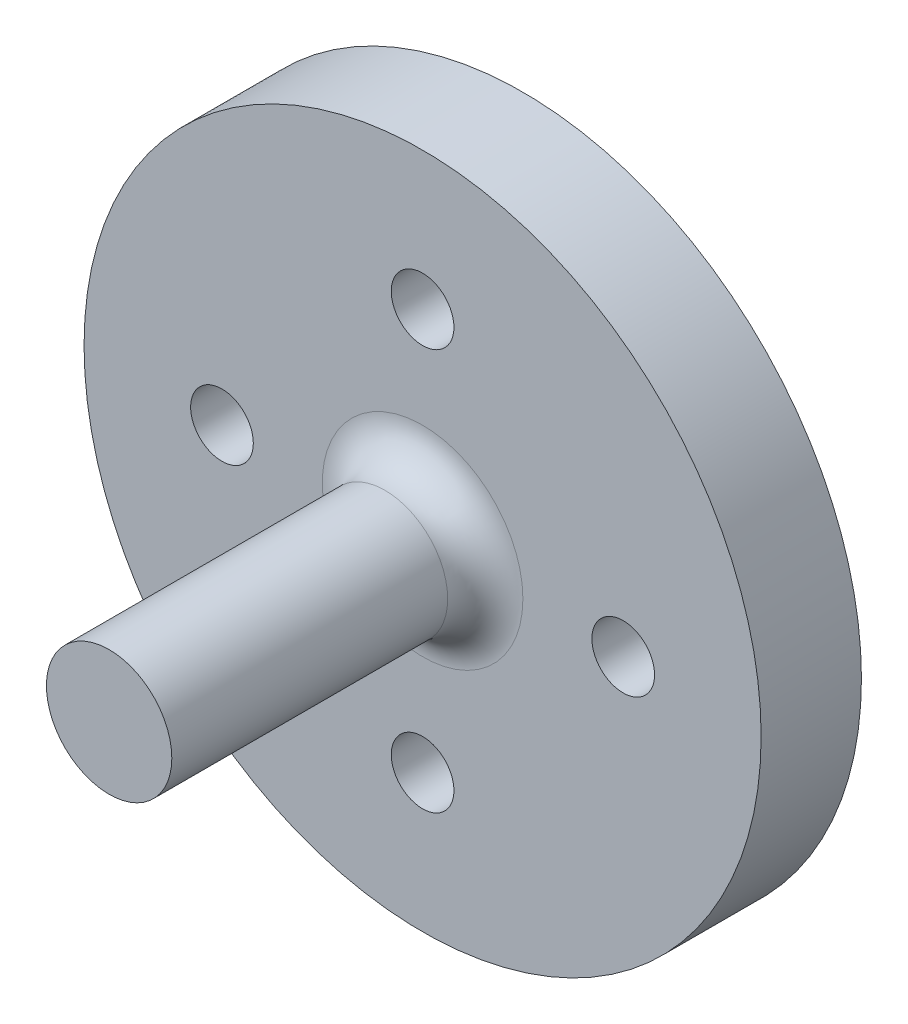
from build123d import *

# Parameters (mm, degrees)
SKETCH1_R           = 27
BOSS_EXTRUDE1_DEPTH = 8
SKETCH2_R           = 2.5
CUT_EXTRUDE1_DEPTH  = 8
SKETCH3_R           = 5
BOSS_EXTRUDE2_DEPTH = 25
FILLET1_R           = 3


with BuildPart() as part:
    # Sketch1 → Boss-Extrude1 (new body)
    with BuildSketch(Plane.XY):
        Circle(SKETCH1_R)
    extrude(amount=BOSS_EXTRUDE1_DEPTH)

    # Sketch2 → Cut-Extrude1 (cut)
    with BuildSketch(Plane.XY.offset(8)):
        with Locations((-16, 0)):
            Circle(SKETCH2_R)
        with Locations((0, 16)):
            Circle(SKETCH2_R)
        with Locations((16, 0)):
            Circle(SKETCH2_R)
        with Locations((0, -16)):
            Circle(SKETCH2_R)
    extrude(amount=-CUT_EXTRUDE1_DEPTH, mode=Mode.SUBTRACT)

    # Sketch3 → Boss-Extrude2 (add)
    with BuildSketch(Plane.XY.offset(8)):
        Circle(SKETCH3_R)
    extrude(amount=BOSS_EXTRUDE2_DEPTH)

    # Fillet1
    fillet1_edges = [part.edges().sort_by_distance(p)[0] for p in [
        (-5, 0, 8),
    ]]
    fillet(fillet1_edges, radius=FILLET1_R)


solid = part.part
